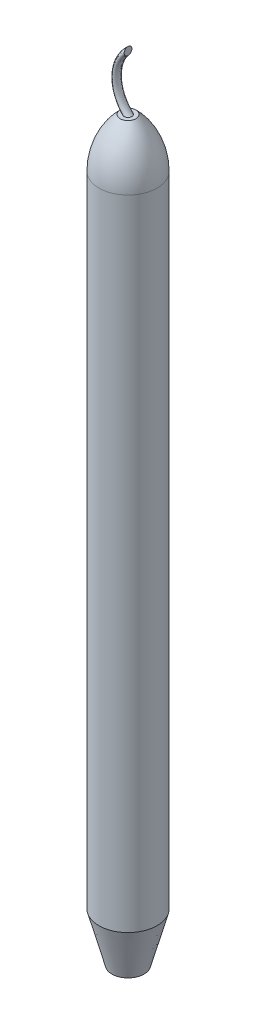
from build123d import *

# Parameters (mm, degrees)
SKETCH7_R = 2


with BuildPart() as part:
    # Sketch1 → Revolve1 (revolve)
    with BuildSketch(Plane.XY, mode=Mode.PRIVATE) as revolve1_sk:
        with BuildLine():
            Line((0, 0), (0, 380))
            Line((0, 380), (4, 380))
            ThreePointArc((4, 380), (12.132538026, 368.39895852), (15, 354.524521594))
            Line((15, 354.524521594), (15, 25))
            Line((15, 25), (8.301270189, 0))
            Line((8.301270189, 0), (0, 0))
        make_face()
    revolve(revolve1_sk.sketch.rotate(Axis((0, 0, 0), (0, 1, 0)), 90), axis=Axis((0, 0, 0), (0, 1, 0)))

    # Sweep6: sweep along a path in Sketch11
    with BuildLine(Plane.XY) as sweep6_path:
        ThreePointArc((0, 380), (-5.857864376, 394.142135624), (0, 408.284271247))
    # Sketch7 → Sweep6 (sweep)
    with BuildSketch(Plane(origin=(0, 380, 0), x_dir=(1, 0, 0), z_dir=(0, 1, 0))):
        Circle(SKETCH7_R)
    sweep(path=sweep6_path.line)


solid = part.part
